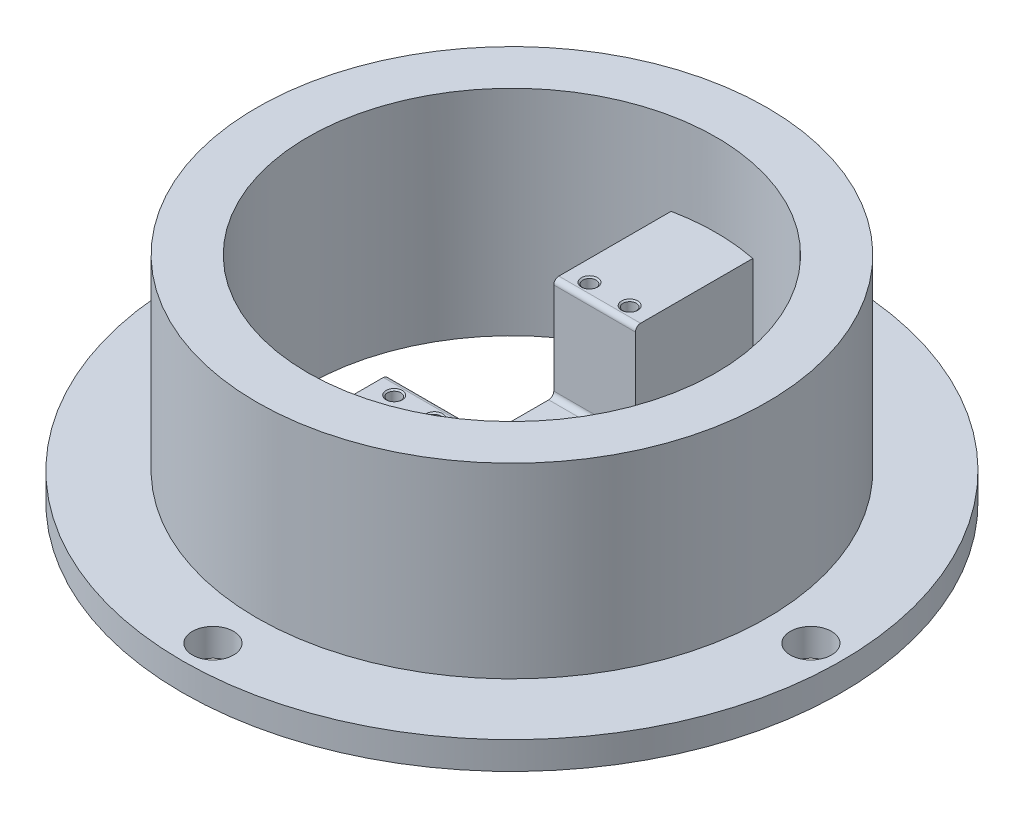
from build123d import *

# Parameters (mm, degrees)
SKETCH2_R                       = 63.5
SKETCH2_R_2                     = 50.8
BOSS_EXTRUDE1_DEPTH             = 53.34
SKETCH4_R                       = 82.015423661
BOSS_EXTRUDE3_DEPTH             = 6.858
CUT_EXTRUDE2_DEPTH              = 125.954534773
CUT_EXTRUDE2_DEPTH_BACK         = 125.954534773
SKETCH6_R                       = 5.121456342
CUT_EXTRUDE3_DEPTH              = 125.954534773
CUT_EXTRUDE3_DEPTH_BACK         = 125.954534773
SKETCH9_W                       = 20.32
SKETCH9_H                       = 38.475908221
BOSS_EXTRUDE4_DEPTH             = 25.908
CUT_EXTRUDE5_DEPTH              = 121.526636859
CUT_EXTRUDE5_DEPTH_BACK         = 25.4
SKETCH11_W                      = 20.32
SKETCH11_H                      = 41.148
FILLET1_R                       = 1.27
M4X0_7_TAPPED_HOLE3_D           = 3.3
M4X0_7_TAPPED_HOLE3_DEPTH       = 9.906
M4X0_7_TAPPED_HOLE3_CSINK_D     = 4.05
M4X0_7_TAPPED_HOLE3_CSINK_ANGLE = 100
M4X0_7_TAPPED_HOLE3_TIP         = 0.991420021


with BuildPart() as part:
    # Sketch2 → Boss-Extrude1 (new body)
    with BuildSketch(Plane(origin=(0, 0, 0), x_dir=(1, 0, 0), z_dir=(0, 1, 0))):
        with Locations(Location((0, 0, 0), (0, 0, 270))):
            Circle(SKETCH2_R)
        with Locations(Location((0, 0, 0), (0, 0, 270))):
            Circle(SKETCH2_R_2, mode=Mode.SUBTRACT)
    extrude(amount=BOSS_EXTRUDE1_DEPTH)

    # Sketch4 → Boss-Extrude3 (add)
    with BuildSketch(Plane(origin=(0, 0, 0), x_dir=(1, 0, 0), z_dir=(0, 1, 0))):
        with Locations(Location((0, 0, 0), (0, 0, 270))):
            Circle(SKETCH4_R)
    extrude(amount=BOSS_EXTRUDE3_DEPTH)

    # Sketch6 → Cut-Extrude2 (cut, two sides: drawn at the far end of the back side and taken through both)
    with BuildSketch(Plane(origin=(0, 6.858, 0), x_dir=(1, 0, 0), z_dir=(0, 1, 0)).offset(-CUT_EXTRUDE2_DEPTH_BACK)):
        with Locations(Location((0, 74.395423661, 0), (0, 0, 270))):
            Circle(SKETCH6_R)
        with Locations(Location((-74.649423661, 0, 0), (0, 0, 270))):
            Circle(SKETCH6_R)
        with Locations(Location((74.395423661, 0, 0), (0, 0, 270))):
            Circle(SKETCH6_R)
        with Locations(Location((0, -74.395423661, 0), (0, 0, 270))):
            Circle(SKETCH6_R)
    extrude(amount=CUT_EXTRUDE2_DEPTH + CUT_EXTRUDE2_DEPTH_BACK, mode=Mode.SUBTRACT)

    # Sketch8 → Cut-Extrude3 (cut, two sides: drawn at the far end of the back side and taken through both)
    with BuildSketch(Plane(origin=(0, 6.858, 0), x_dir=(1, 0, 0), z_dir=(0, 1, 0)).offset(-CUT_EXTRUDE3_DEPTH_BACK)):
        with BuildLine():
            Line((-10.16, 49.773631573), (-10.16, -49.773631573))
            ThreePointArc((-10.16, -49.773631573), (-50.8, 0), (-10.16, 49.773631573))
        make_face()
        with BuildLine():
            Line((10.16, 49.773631573), (10.16, -49.773631573))
            ThreePointArc((10.16, -49.773631573), (50.8, 0), (10.16, 49.773631573))
        make_face()
    extrude(amount=CUT_EXTRUDE3_DEPTH + CUT_EXTRUDE3_DEPTH_BACK, mode=Mode.SUBTRACT)

    # Sketch9 → Boss-Extrude4 (add)
    with BuildSketch(Plane(origin=(0, 6.858, 0), x_dir=(1, 0, 0), z_dir=(0, 1, 0))):
        with Locations((0, 30.667954111)):
            Rectangle(SKETCH9_W, SKETCH9_H)
        with BuildLine():
            Line((-10.16, 49.773631573), (-10.16, -49.773631573))
            ThreePointArc((-10.16, -49.773631573), (0, -50.8), (10.16, -49.773631573))
            Line((10.16, -49.773631573), (10.16, 49.773631573))
            ThreePointArc((10.16, 49.773631573), (0, 50.8), (-10.16, 49.773631573))
        make_face()
    extrude(amount=BOSS_EXTRUDE4_DEPTH)

    # Sketch11 → Cut-Extrude5 (cut, two sides: drawn at the far end of the back side and taken through both)
    with BuildSketch(Plane(origin=(0, 32.766, 0), x_dir=(1, 0, 0), z_dir=(0, 1, 0)).offset(-CUT_EXTRUDE5_DEPTH_BACK)):
        Rectangle(SKETCH11_W, SKETCH11_H)
    extrude(amount=CUT_EXTRUDE5_DEPTH + CUT_EXTRUDE5_DEPTH_BACK, mode=Mode.SUBTRACT)

    # Fillet1
    fillet1_edges = [part.edges().sort_by_distance(p)[0] for p in [
        (0, 32.766, 20.574),
        (0, 7.366, 20.574),
        (0, 7.366, -20.574),
        (0, 32.766, -20.574),
    ]]
    fillet(fillet1_edges, radius=FILLET1_R)

    # M4x0.7 Tapped Hole3
    with Locations(Plane(origin=(0, 32.766, 0), x_dir=(1, 0, 0), z_dir=(0, 1, 0))):
        with Locations((5, -24.3), (-5, -24.3), (5, 24.3), (-5, 24.3)):
            CounterSinkHole(M4X0_7_TAPPED_HOLE3_D / 2, M4X0_7_TAPPED_HOLE3_CSINK_D / 2, depth=M4X0_7_TAPPED_HOLE3_DEPTH, counter_sink_angle=M4X0_7_TAPPED_HOLE3_CSINK_ANGLE)
            with Locations((0, 0, -(M4X0_7_TAPPED_HOLE3_DEPTH + M4X0_7_TAPPED_HOLE3_TIP / 2))):  # 118° drill point
                Cone(0, M4X0_7_TAPPED_HOLE3_D / 2, M4X0_7_TAPPED_HOLE3_TIP, mode=Mode.SUBTRACT)


solid = part.part
